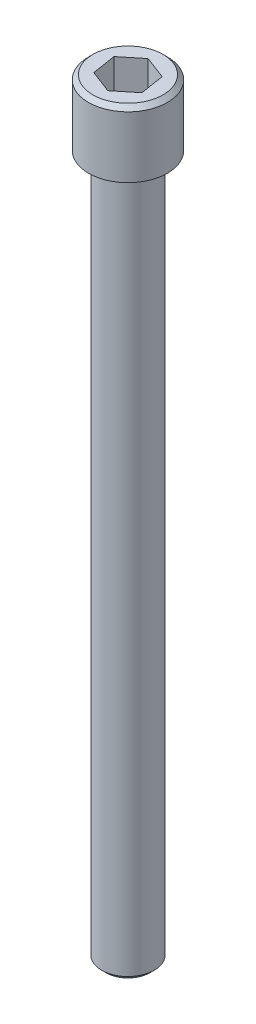
from build123d import *

# Parameters (mm, degrees)
SKICA1_R                 = 1.5
P_IDAT_VYSUNUT_M1_DEPTH  = 40
SKICA2_R                 = 2.25
P_IDAT_VYSUNUT_M2_DEPTH  = 3.75
ODEBRAT_VYSUNUT_M1_DEPTH = 2.25
ZKOSEN_1_SIZE            = 0.25
ZKOSEN_2_SIZE            = 0.25


with BuildPart() as part:
    # Skica1 → Přidat vysunutím1 (new body)
    with BuildSketch(Plane(origin=(0, 0, 0), x_dir=(1, 0, 0), z_dir=(0, 1, 0))):
        with Locations(Location((0, 0, 0), (0, 0, 270))):
            Circle(SKICA1_R)
    extrude(amount=P_IDAT_VYSUNUT_M1_DEPTH)

    # Skica2 → Přidat vysunutím2 (add)
    with BuildSketch(Plane(origin=(0, 40, 0), x_dir=(1, 0, 0), z_dir=(0, 1, 0))):
        with Locations(Location((0, 0, 0), (0, 0, 270))):
            Circle(SKICA2_R)
    extrude(amount=P_IDAT_VYSUNUT_M2_DEPTH)

    # Skica3 → Odebrat vysunutím1 (cut)
    with BuildSketch(Plane(origin=(0, 43.75, 0), x_dir=(1, 0, 0), z_dir=(0, 1, 0))):
        Polygon((-1.074402598, -0.875019461), (0.220587783, -1.367969674), (1.294990381, -0.492950213), (1.074402598, 0.875019461), (-0.220587783, 1.367969674), (-1.294990381, 0.492950213), align=None)
    extrude(amount=-ODEBRAT_VYSUNUT_M1_DEPTH, mode=Mode.SUBTRACT)

    # Zkosení1
    zkosen_1_edges = [part.edges().sort_by_distance(p)[0] for p in [
        (0, 43.75, -2.25),
    ]]
    chamfer(zkosen_1_edges, length=ZKOSEN_1_SIZE)

    # Zkosení2
    zkosen_2_edges = [part.edges().sort_by_distance(p)[0] for p in [
        (0, 0, -1.5),
    ]]
    chamfer(zkosen_2_edges, length=ZKOSEN_2_SIZE)


solid = part.part
